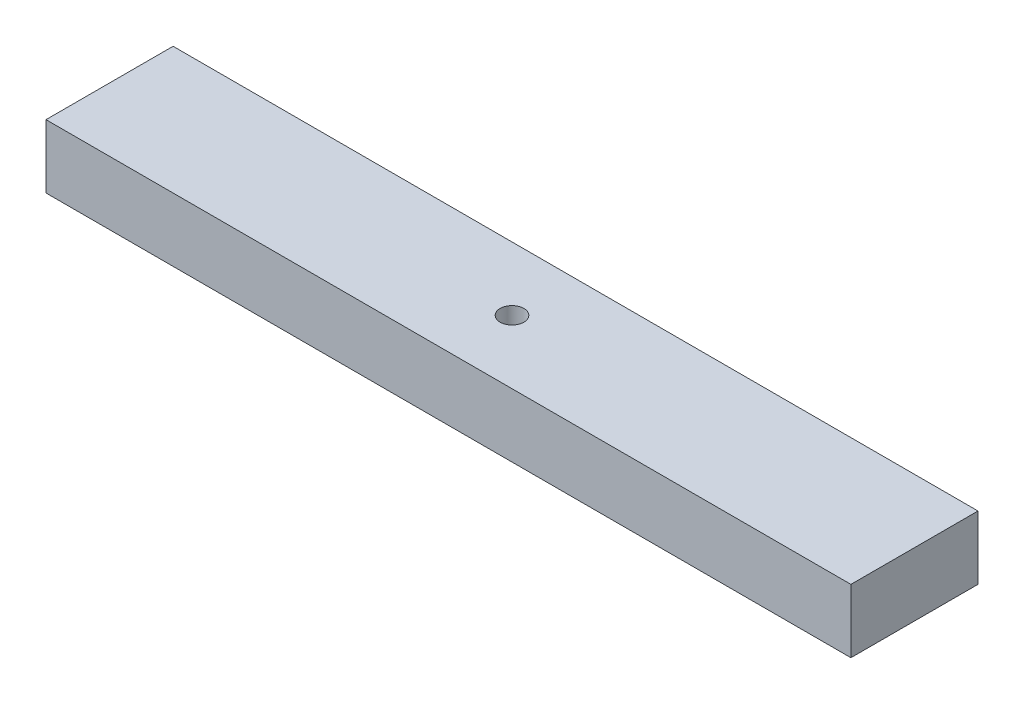
from build123d import *

# Parameters (mm, degrees)
ESQUISSE1_W             = 304
ESQUISSE1_H             = 48
BOSS_EXTRU_1_DEPTH      = 24
ESQUISSE2_R             = 4.5
ENL_V_MAT_EXTRU_1_DEPTH = 156.743378671
ESQUISSE3_R             = 7
ENL_V_MAT_EXTRU_2_DEPTH = 12


with BuildPart() as part:
    # Esquisse1 → Boss.-Extru.1 (new body)
    with BuildSketch(Plane(origin=(0, 0, 0), x_dir=(1, 0, 0), z_dir=(0, 1, 0))):
        Rectangle(ESQUISSE1_W, ESQUISSE1_H)
    extrude(amount=BOSS_EXTRU_1_DEPTH)

    # Esquisse2 → Enlèv. mat.-Extru.1 (cut, through all)
    with BuildSketch(Plane(origin=(0, 24, 0), x_dir=(1, 0, 0), z_dir=(0, 1, 0))):
        with Locations(Location((0, 0, 0), (0, 0, 270))):
            Circle(ESQUISSE2_R)
    extrude(amount=-ENL_V_MAT_EXTRU_1_DEPTH, mode=Mode.SUBTRACT)

    # Esquisse3 → Enlèv. mat.-Extru.2 (cut)
    with BuildSketch(Plane.XZ):
        with Locations(Location((0, 0, 0), (0, 0, 270))):
            Circle(ESQUISSE3_R)
    extrude(amount=-ENL_V_MAT_EXTRU_2_DEPTH, mode=Mode.SUBTRACT)


solid = part.part
